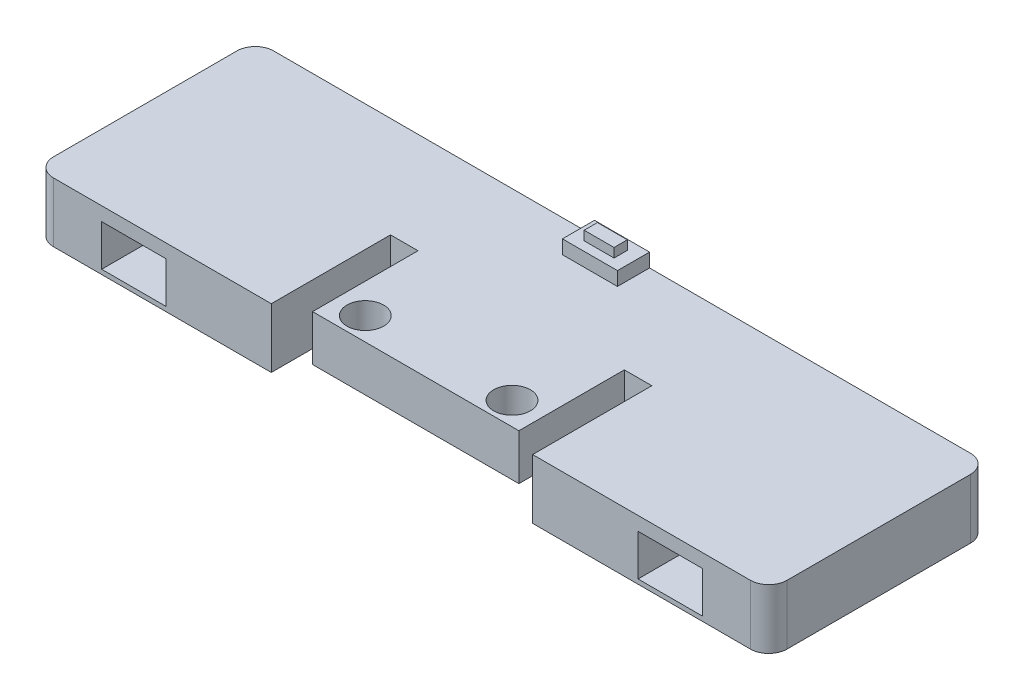
from build123d import *

# Parameters (mm, degrees)
SKETCH_1_W          = 80
SKETCH_1_H          = 24
EXTRUDE_1_DEPTH     = 6.5
SKETCH_2_W          = 6
SKETCH_2_H          = 3.5
EXTRUDE_2_DEPTH     = 1.5
SKETCH_3_W          = 3.260064366
SKETCH_3_H          = 1.448917496
EXTRUDE_3_DEPTH     = 1
SKETCH_4_R          = 2
CUT_EXTRUDE_1_DEPTH = 43.264050918
SKETCH_5_W          = 7
SKETCH_5_H          = 4.5
CUT_EXTRUDE_2_DEPTH = 6
SKETCH_6_W          = 28.5
SKETCH_6_H          = 13
CUT_EXTRUDE_3_DEPTH = 1.5
SKETCH_7_R          = 1.70863254
SKETCH_7_R_2        = 1.631149792
SKETCH_7_W          = 3.41726508
SKETCH_7_H          = 3.018578117
SKETCH_7_W_2        = 2.535605619
SKETCH_7_H_2        = 2.656348743
CUT_EXTRUDE_4_DEPTH = 1
FILLET_1_R          = 2


with BuildPart() as part:
    # 草图1 → 凸台-拉伸1 (new body)
    with BuildSketch(Plane(origin=(0, 0, 0), x_dir=(1, 0, 0), z_dir=(0, 1, 0))):
        Rectangle(SKETCH_1_W, SKETCH_1_H)
    extrude(amount=EXTRUDE_1_DEPTH)

    # 草图2 → 凸台-拉伸2 (add)
    with BuildSketch(Plane(origin=(0, 6.5, 0), x_dir=(1, 0, 0), z_dir=(0, 1, 0))):
        with Locations((0, 10.25)):
            Rectangle(SKETCH_2_W, SKETCH_2_H)
    extrude(amount=EXTRUDE_2_DEPTH)

    # 草图3 → 凸台-拉伸3 (add)
    with BuildSketch(Plane(origin=(0, 8, 0), x_dir=(1, 0, 0), z_dir=(0, 1, 0))):
        with Locations((0, 10.22231269)):
            Rectangle(SKETCH_3_W, SKETCH_3_H)
    extrude(amount=EXTRUDE_3_DEPTH)

    # 草图4 → 切除-拉伸1 (cut, through all)
    with BuildSketch(Plane(origin=(0, 6.5, 0), x_dir=(1, 0, 0), z_dir=(0, 1, 0))):
        with Locations(Location((-8, -8, 0), (0, 0, 270))):
            Circle(SKETCH_4_R)
        with Locations(Location((8, -8, 0), (0, 0, 270))):
            Circle(SKETCH_4_R)
        Polygon((-14.25, -12), (-14.25, 1), (-11.25, 1), (-11.25, -10.5), (11.25, -10.5), (11.25, 1), (14.25, 1), (14.25, -12), (11.25, -12), (-11.25, -12), align=None)
    extrude(amount=-CUT_EXTRUDE_1_DEPTH, mode=Mode.SUBTRACT)

    # 草图5 → 切除-拉伸2 (cut)
    with BuildSketch(Plane.XY.offset(12)):
        with Locations((-29.25, 2.75)):
            Rectangle(SKETCH_5_W, SKETCH_5_H)
        with Locations((29.25, 2.75)):
            Rectangle(SKETCH_5_W, SKETCH_5_H)
    extrude(amount=-CUT_EXTRUDE_2_DEPTH, mode=Mode.SUBTRACT)

    # 草图6 → 切除-拉伸3 (cut)
    with BuildSketch(Plane.XZ):
        with Locations((0, 5.5)):
            Rectangle(SKETCH_6_W, SKETCH_6_H)
    extrude(amount=-CUT_EXTRUDE_3_DEPTH, mode=Mode.SUBTRACT)

    # 草图7 → 切除-拉伸4 (cut)
    with BuildSketch(Plane.XZ):
        with Locations(Location((-32.962873036, -4.761215966, 0), (0, 0, 270))):
            Circle(SKETCH_7_R)
        with Locations(Location((-10.685766534, -4.761215966, 0), (0, 0, 270))):
            Circle(SKETCH_7_R_2)
        with Locations(Location((10.685766534, -4.761215966, 0), (0, 0, 90))):
            Circle(SKETCH_7_R_2)
        with Locations(Location((32.962873036, -4.761215966, 0), (0, 0, 90))):
            Circle(SKETCH_7_R)
        with Locations((-32.962873036, -9.409826265)):
            Rectangle(SKETCH_7_W, SKETCH_7_H)
        with Locations((-10.685766534, -8.98722533)):
            Rectangle(SKETCH_7_W_2, SKETCH_7_H_2)
        with Locations((10.685766534, -8.98722533)):
            Rectangle(SKETCH_7_W_2, SKETCH_7_H_2)
        with Locations((32.962873036, -9.409826265)):
            Rectangle(SKETCH_7_W, SKETCH_7_H)
    extrude(amount=-CUT_EXTRUDE_4_DEPTH, mode=Mode.SUBTRACT)

    # 圆角1
    fillet_1_edges = [part.edges().sort_by_distance(p)[0] for p in [
        (40, 3.25, 12),
        (-40, 3.25, 12),
        (-40, 3.25, -12),
        (40, 3.25, -12),
    ]]
    fillet(fillet_1_edges, radius=FILLET_1_R)


solid = part.part
